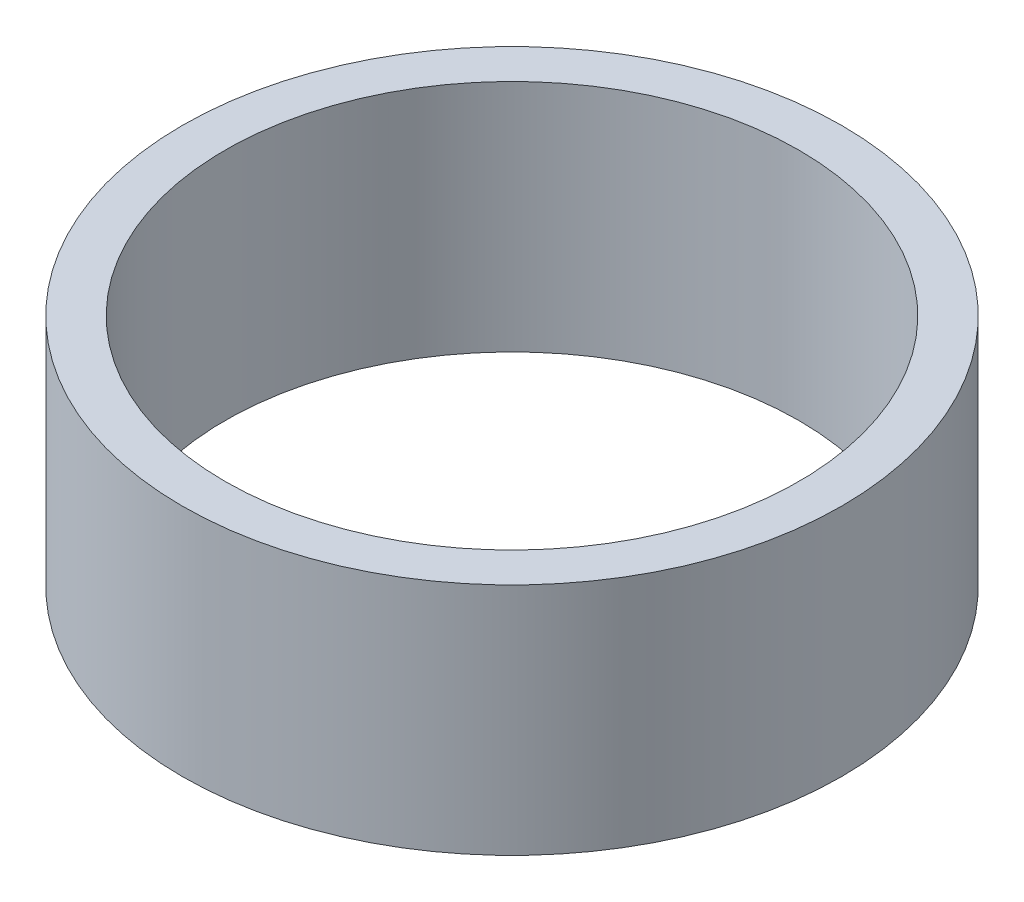
from build123d import *

# Parameters (mm, degrees)
SKETCH1_W = 9.271
SKETCH1_H = 50.8


with BuildPart() as part:
    # Sketch1 → Revolve1 (revolve)
    with BuildSketch(Plane.XY, mode=Mode.PRIVATE) as revolve1_sk:
        with Locations((66.8655, 25.4)):
            Rectangle(SKETCH1_W, SKETCH1_H)
    revolve(revolve1_sk.sketch.rotate(Axis((0, 0, 0), (0, 1, 0)), 90), axis=Axis((0, 0, 0), (0, 1, 0)))


solid = part.part
